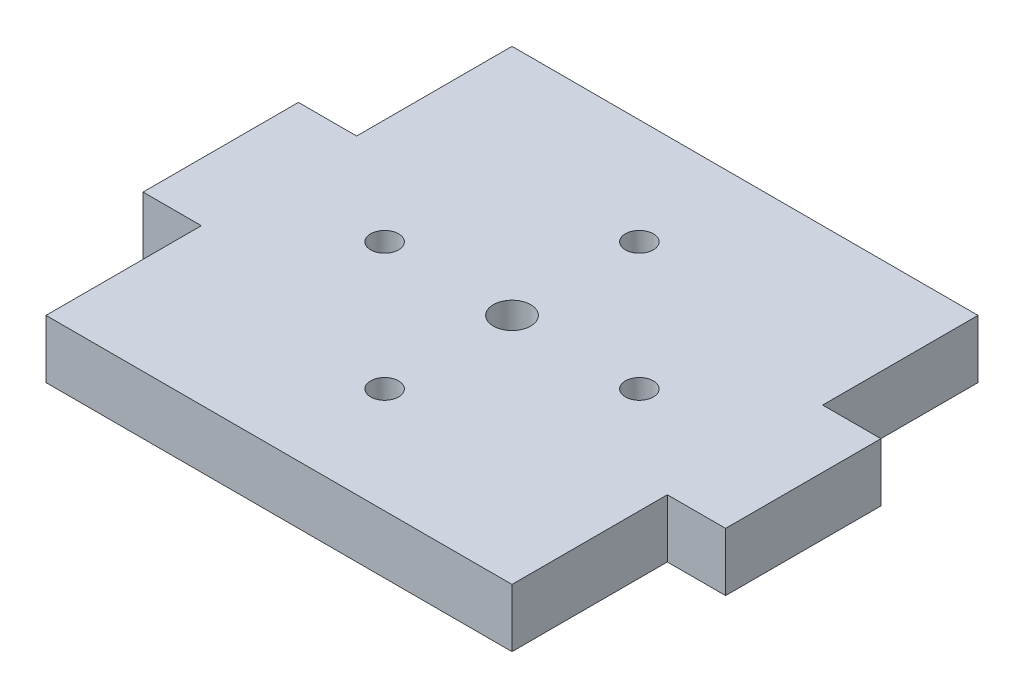
from build123d import *

# Parameters (mm, degrees)
SKETCH1_R           = 1.524
SKETCH1_R_2         = 1.143
BOSS_EXTRUDE1_DEPTH = 4.7625


with BuildPart() as part:
    # Sketch1 → Boss-Extrude1 (new body)
    with BuildSketch(Plane(origin=(0, 0, 0), x_dir=(1, 0, 0), z_dir=(0, 1, 0))):
        Polygon((0, 0), (0, 12.7), (-4.7625, 12.7), (-4.7625, 25.4), (0, 25.4), (0, 38.1), (38.1, 38.1), (38.1, 25.4), (42.8625, 25.4), (42.8625, 12.7), (38.1, 12.7), (38.1, 0), align=None)
        with Locations(Location((19.05, 19.05, 0), (0, 0, 90))):
            Circle(SKETCH1_R, mode=Mode.SUBTRACT)
        with Locations(Location((29.464, 19.05, 0), (0, 0, 90))):
            Circle(SKETCH1_R_2, mode=Mode.SUBTRACT)
        with Locations(Location((19.05, 8.636, 0), (0, 0, 90))):
            Circle(SKETCH1_R_2, mode=Mode.SUBTRACT)
        with Locations(Location((8.636, 19.05, 0), (0, 0, 90))):
            Circle(SKETCH1_R_2, mode=Mode.SUBTRACT)
        with Locations(Location((19.05, 29.464, 0), (0, 0, 90))):
            Circle(SKETCH1_R_2, mode=Mode.SUBTRACT)
    extrude(amount=BOSS_EXTRUDE1_DEPTH)


solid = part.part
